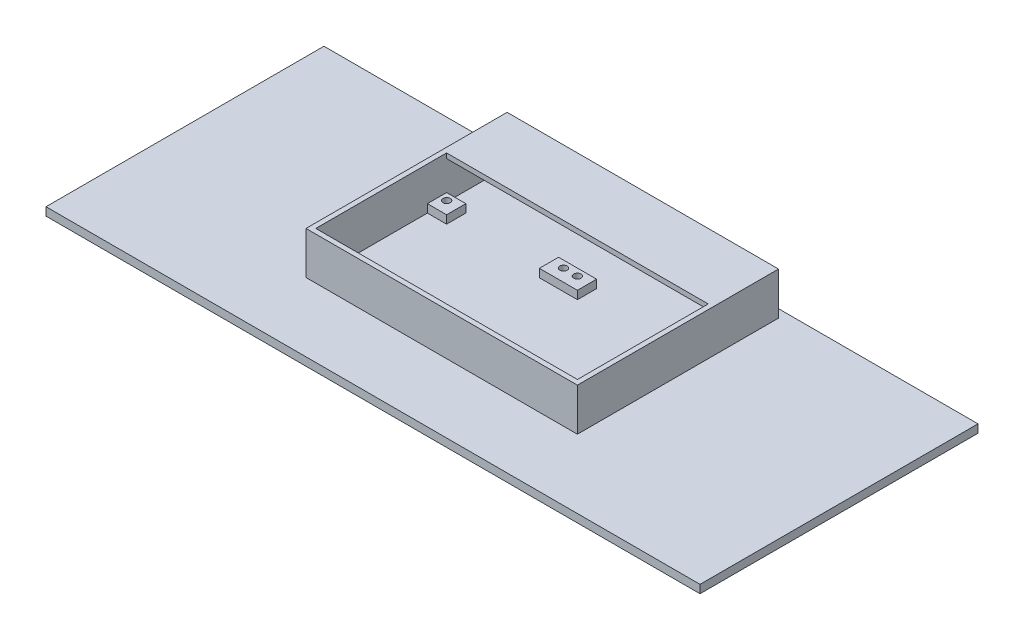
from build123d import *

# Parameters (mm, degrees)
SKIZZE1_W                       = 400
SKIZZE1_H                       = 170
AUFSATZ_LINEAR_AUSTRAGEN1_DEPTH = 5
SKIZZE3_W                       = 11.75
SKIZZE3_H                       = 11.75
SKIZZE3_R                       = 2.25
SKIZZE3_W_2                     = 11.5
SKIZZE3_H_2                     = 11.5
SKIZZE3_W_3                     = 23.5
SKIZZE3_W_4                     = 23.25
AUFSATZ_LINEAR_AUSTRAGEN6_DEPTH = 5
AUFSATZ_LINEAR_AUSTRAGEN7_DEPTH = 26
SKIZZE6_W                       = 160
SKIZZE6_H                       = 40
AUFSATZ_LINEAR_AUSTRAGEN8_DEPTH = 3


with BuildPart() as part:
    # Skizze1 → Aufsatz-Linear austragen1 (new body)
    with BuildSketch(Plane(origin=(0, 0, 0), x_dir=(1, 0, 0), z_dir=(0, 1, 0))):
        Rectangle(SKIZZE1_W, SKIZZE1_H)
    extrude(amount=AUFSATZ_LINEAR_AUSTRAGEN1_DEPTH)

    # Skizze3 → Aufsatz-Linear austragen6 (add)
    # profile 1 of 6: a face of its own
    with BuildSketch(Plane(origin=(0, 5, 0), x_dir=(1, 0, 0), z_dir=(0, 1, 0))):
        with Locations((74.125, 34.125)):
            Rectangle(SKIZZE3_W, SKIZZE3_H)
        with Locations(Location((75.75, 35.75, 0), (0, 0, 270))):
            Circle(SKIZZE3_R, mode=Mode.SUBTRACT)
    # profile 2 of 6: a face of its own
    with BuildSketch(Plane(origin=(0, 5, 0), x_dir=(1, 0, 0), z_dir=(0, 1, 0))):
        with Locations((-74.125, 34.125)):
            Rectangle(SKIZZE3_W, SKIZZE3_H)
        with Locations(Location((-75.75, 35.75, 0), (0, 0, 270))):
            Circle(SKIZZE3_R, mode=Mode.SUBTRACT)
    # profile 3 of 6: a face of its own
    with BuildSketch(Plane(origin=(0, 5, 0), x_dir=(1, 0, 0), z_dir=(0, 1, 0))):
        with Locations((-74.125, -34.125)):
            Rectangle(SKIZZE3_W, SKIZZE3_H)
        with Locations(Location((-75.75, -35.75, 0), (0, 0, 270))):
            Circle(SKIZZE3_R, mode=Mode.SUBTRACT)
    # profile 4 of 6: a face of its own
    with BuildSketch(Plane(origin=(0, 5, 0), x_dir=(1, 0, 0), z_dir=(0, 1, 0))):
        with Locations((74.25, -34.25)):
            Rectangle(SKIZZE3_W_2, SKIZZE3_H_2)
        with Locations(Location((76, -36, 0), (0, 0, 270))):
            Circle(SKIZZE3_R, mode=Mode.SUBTRACT)
    # profile 5 of 6: a face of its own
    with BuildSketch(Plane(origin=(0, 5, 0), x_dir=(1, 0, 0), z_dir=(0, 1, 0))):
        with Locations((0, -34.125)):
            Rectangle(SKIZZE3_W_3, SKIZZE3_H)
        with Locations(Location((-4.25, -35.75, 0), (0, 0, 270))):
            Circle(SKIZZE3_R, mode=Mode.SUBTRACT)
        with Locations(Location((4.25, -35.75, 0), (0, 0, 270))):
            Circle(SKIZZE3_R, mode=Mode.SUBTRACT)
    # profile 6 of 6: a face of its own
    with BuildSketch(Plane(origin=(0, 5, 0), x_dir=(1, 0, 0), z_dir=(0, 1, 0))):
        with Locations((0.125, 34.125)):
            Rectangle(SKIZZE3_W_4, SKIZZE3_H)
        with Locations(Location((-4.25, 35.75, 0), (0, 0, 270))):
            Circle(SKIZZE3_R, mode=Mode.SUBTRACT)
        with Locations(Location((4.25, 35.75, 0), (0, 0, 270))):
            Circle(SKIZZE3_R, mode=Mode.SUBTRACT)
    extrude(amount=AUFSATZ_LINEAR_AUSTRAGEN6_DEPTH)

    # Skizze4 → Aufsatz-Linear austragen7 (add)
    with BuildSketch(Plane(origin=(0, 5, 0), x_dir=(1, 0, 0), z_dir=(0, 1, 0))):
        Polygon((-83, 80), (-83, -40), (-80, -40), (-80, -28.25), (-80, 28.25), (-80, 40), (-80, 80), align=None)
        Polygon((83, -40), (80, -40), (68.5, -40), (11.75, -40), (-11.75, -40), (-68.25, -40), (-80, -40), (-83, -40), (-83, -43), (83, -43), align=None)
        Polygon((80, -28.5), (80, -40), (83, -40), (83, 80), (80, 80), (80, 40), (80, 28.25), align=None)
    extrude(amount=AUFSATZ_LINEAR_AUSTRAGEN7_DEPTH)

    # Skizze6 → Aufsatz-Linear austragen8 (add)
    with BuildSketch(Plane(origin=(0, 31, 0), x_dir=(1, 0, 0), z_dir=(0, 1, 0))):
        with Locations((0, 60)):
            Rectangle(SKIZZE6_W, SKIZZE6_H)
    extrude(amount=-AUFSATZ_LINEAR_AUSTRAGEN8_DEPTH)


solid = part.part
